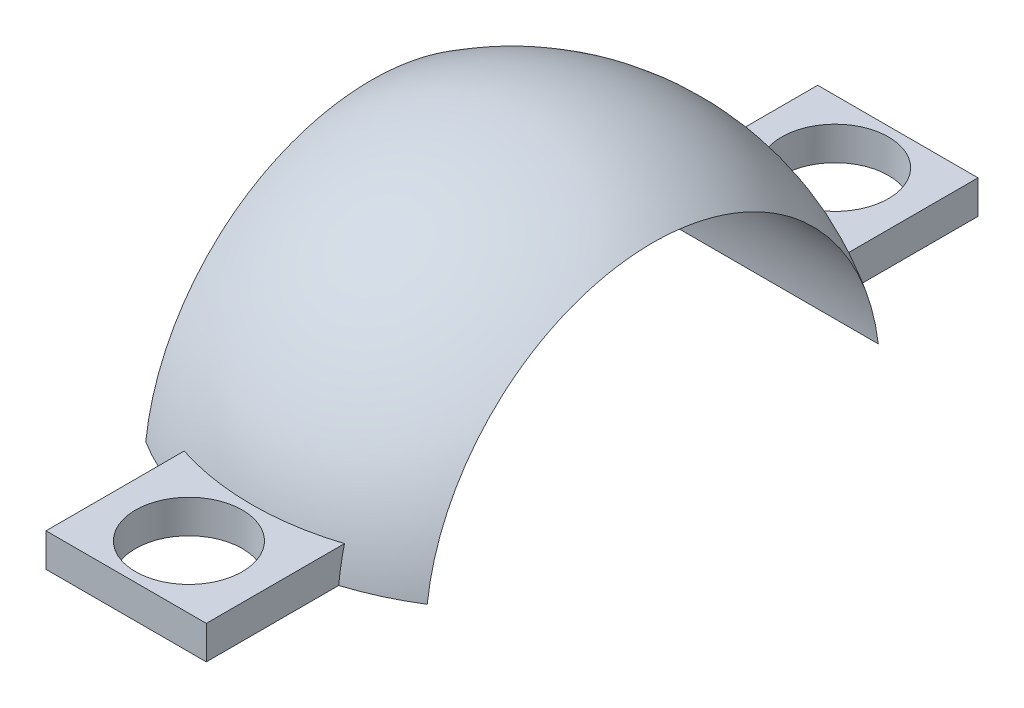
from build123d import *

# Parameters (mm, degrees)
SKETCH2_R                = 10
BOSS_EXTRUDE1_DEPTH      = 30
CUT_EXTRUDE1_START       = -10
SKETCH3_R                = 10
SKETCH3_R_2              = 7.5
CUT_EXTRUDE1_DEPTH       = 10
CUT_EXTRUDE3_DEPTH       = 10
CUT_EXTRUDE3_DEPTH_BACK  = 10
SKETCH5_R                = 2
FILLET2_R                = 10
BOSS_EXTRUDE2_START      = -67.5
SKETCH7_R                = 10
BOSS_EXTRUDE2_DEPTH      = 67.5
SKETCH8_R                = 50
SKETCH8_R_2              = 10
CUT_EXTRUDE6_DEPTH       = 107.770782567
SKETCH9_R                = 7.5
CUT_EXTRUDE7_DEPTH       = 10
CUT_EXTRUDE8_DEPTH       = 10
CUT_EXTRUDE8_DEPTH_BACK  = 10
SKETCH10_R               = 2
CUT_EXTRUDE9_START       = -60
SKETCH11_R               = 10
SKETCH11_R_2             = 7.5
CUT_EXTRUDE9_DEPTH       = 60
CUT_EXTRUDE10_START      = -60
SKETCH12_R               = 7.5
CUT_EXTRUDE10_DEPTH      = 60
CUT_EXTRUDE11_DEPTH      = 60
CUT_EXTRUDE11_DEPTH_BACK = 60
SKETCH14_R               = 8.5
CUT_EXTRUDE12_DEPTH      = 60
CUT_EXTRUDE12_DEPTH_BACK = 60
SKETCH15_W               = 22.666202576
SKETCH15_H               = 2
BOSS_EXTRUDE3_DEPTH      = 3
BOSS_EXTRUDE3_DEPTH_BACK = 3
SKETCH16_W               = 6
SKETCH16_H               = 1.25
SKETCH18_R               = 2
CUT_EXTRUDE13_DEPTH      = 6.5
CUT_EXTRUDE14_DEPTH      = 12.5
CUT_EXTRUDE14_DEPTH_BACK = 16.5
SKETCH19_W               = 29.24547319
SKETCH19_H               = 20.10627683


with BuildPart() as part:
    # Sketch1 → Revolve1 (revolve)
    with BuildSketch(Plane.XY):
        Polygon((50, 25), (0, 25), (0, 22.5), (45, 22.5), (45, -22.5), (0, -22.5), (0, -25), (50, -25), align=None)
    revolve(axis=Axis((0, -25, 0), (0, 1, 0)))

    # Sketch2 → Boss-Extrude1 (add)
    with BuildSketch(Plane(origin=(0, 25, 0), x_dir=(1, 0, 0), z_dir=(0, 1, 0))):
        with Locations(Location((0, 0, 0), (0, 0, 180))):
            Circle(SKETCH2_R)
    extrude(amount=BOSS_EXTRUDE1_DEPTH)

    # Sketch3 → Cut-Extrude1 (cut)
    with BuildSketch(Plane(origin=(0, 55, 0), x_dir=(1, 0, 0), z_dir=(0, 1, 0)).offset(CUT_EXTRUDE1_START)):
        with Locations(Location((0, 0, 0), (0, 0, 180))):
            Circle(SKETCH3_R)
        with Locations(Location((0, 0, 0), (0, 0, 180))):
            Circle(SKETCH3_R_2, mode=Mode.SUBTRACT)
    extrude(amount=CUT_EXTRUDE1_DEPTH, mode=Mode.SUBTRACT)

    # Sketch5 → Cut-Extrude3 (cut, two sides: drawn at the far end of the back side and taken through both)
    with BuildSketch(Plane(origin=(0, 0, 0), x_dir=(0, 0, -1), z_dir=(1, 0, 0)).offset(-CUT_EXTRUDE3_DEPTH_BACK)):
        with Locations(Location((0, 50, 0), (0, 0, 180))):
            Circle(SKETCH5_R)
    extrude(amount=CUT_EXTRUDE3_DEPTH + CUT_EXTRUDE3_DEPTH_BACK, mode=Mode.SUBTRACT)

    # Fillet2
    fillet2_edges = [part.edges().sort_by_distance(p)[0] for p in [
        (-50, 25, 0),
    ]]
    fillet(fillet2_edges, radius=FILLET2_R)

    # Sketch7 → Boss-Extrude2 (add)
    with BuildSketch(Plane(origin=(0, 45, 0), x_dir=(1, 0, 0), z_dir=(0, 1, 0)).offset(BOSS_EXTRUDE2_START)):
        with Locations(Location((0, 0, 0), (0, 0, 180))):
            Circle(SKETCH7_R)
    extrude(amount=BOSS_EXTRUDE2_DEPTH)

    # Sketch8 → Cut-Extrude6 (cut, through all)
    with BuildSketch(Plane(origin=(0, 55, 0), x_dir=(1, 0, 0), z_dir=(0, 1, 0))):
        Circle(SKETCH8_R)
        with Locations(Location((0, 0, 0), (0, 0, 180))):
            Circle(SKETCH8_R_2, mode=Mode.SUBTRACT)
    extrude(amount=-CUT_EXTRUDE6_DEPTH, mode=Mode.SUBTRACT)

    # Sketch9 → Cut-Extrude7 (cut)
    with BuildSketch(Plane.XZ.offset(25)):
        with Locations(Location((0, 0, 0), (0, 0, 180))):
            Circle(SKETCH9_R)
    extrude(amount=-CUT_EXTRUDE7_DEPTH, mode=Mode.SUBTRACT)

    # Sketch10 → Cut-Extrude8 (cut, two sides: drawn at the far end of the back side and taken through both)
    with BuildSketch(Plane(origin=(0, 0, 0), x_dir=(0, 0, -1), z_dir=(1, 0, 0)).offset(-CUT_EXTRUDE8_DEPTH_BACK)):
        with Locations(Location((0, -20, 0), (0, 0, 180))):
            Circle(SKETCH10_R)
    extrude(amount=CUT_EXTRUDE8_DEPTH + CUT_EXTRUDE8_DEPTH_BACK, mode=Mode.SUBTRACT)

    # Sketch11 → Cut-Extrude9 (cut)
    with BuildSketch(Plane(origin=(0, 55, 0), x_dir=(1, 0, 0), z_dir=(0, 1, 0)).offset(CUT_EXTRUDE9_START)):
        with Locations(Location((0, 0, 0), (0, 0, 180))):
            Circle(SKETCH11_R)
        Circle(SKETCH11_R_2, mode=Mode.SUBTRACT)
    extrude(amount=CUT_EXTRUDE9_DEPTH, mode=Mode.SUBTRACT)

    # Sketch12 → Cut-Extrude10 (cut)
    with BuildSketch(Plane(origin=(0, 55, 0), x_dir=(1, 0, 0), z_dir=(0, 1, 0)).offset(CUT_EXTRUDE10_START)):
        Circle(SKETCH12_R)
    extrude(amount=CUT_EXTRUDE10_DEPTH, mode=Mode.SUBTRACT)

    # Sketch13 → Revolve2 (revolve)
    with BuildSketch(Plane(origin=(0, 0, 0), x_dir=(0, 0, -1), z_dir=(1, 0, 0))):
        with BuildLine():
            Line((0, -15), (0, 5))
            ThreePointArc((0, 5), (-10, -5), (0, -15))
        make_face()
    revolve(axis=Axis((0, -15, 0), (0, 1, 0)))

    # Sketch14 → Cut-Extrude11 (cut, two sides: drawn at the far end of the back side and taken through both)
    with BuildSketch(Plane(origin=(0, 0, 0), x_dir=(0, 0, -1), z_dir=(1, 0, 0)).offset(-CUT_EXTRUDE11_DEPTH_BACK)):
        with Locations(Location((0, -5, 0), (0, 0, 180))):
            Circle(SKETCH14_R)
    extrude(amount=CUT_EXTRUDE11_DEPTH + CUT_EXTRUDE11_DEPTH_BACK, mode=Mode.SUBTRACT)

    # Sketch15 → Cut-Extrude12 (cut, two sides: drawn at the far end of the back side and taken through both)
    with BuildSketch(Plane(origin=(0, 0, 0), x_dir=(0, 0, -1), z_dir=(1, 0, 0)).offset(-CUT_EXTRUDE12_DEPTH_BACK)):
        with Locations((0, -5)):
            Rectangle(SKETCH15_W, SKETCH15_H)
    extrude(amount=CUT_EXTRUDE12_DEPTH + CUT_EXTRUDE12_DEPTH_BACK, mode=Mode.SUBTRACT)


with BuildPart() as cut_extrude12_piece_1:
    # of the separate pieces the step leaves, piece 1, a body of its own (cut_extrude12_pieces)
    add(part.part.solids().sort_by_distance((-10, -25, 0))[0])



with BuildPart() as cut_extrude12_piece_2:
    # of the separate pieces the step leaves, piece 2, a body of its own (cut_extrude12_pieces)
    add(part.part.solids().sort_by_distance((5.267826876, -4, 8.440971508))[0])


with BuildPart() as cut_extrude12_piece_1_1:
    add(cut_extrude12_piece_1.part)

    add(cut_extrude12_piece_2.part)  # Boss-Extrude3 merges Cut-Extrude12 piece 2
    # Sketch16 → Boss-Extrude3 (add, two sides: drawn at the far end of the back side and taken through both)
    with BuildSketch(Plane(origin=(0, 0, 0), x_dir=(0, 0, -1), z_dir=(1, 0, 0)).offset(-BOSS_EXTRUDE3_DEPTH_BACK)):
        with Locations((-11.440971508, -3.375)):
            Rectangle(SKETCH16_W, SKETCH16_H)
        with Locations((11.440971508, -3.375)):
            Rectangle(SKETCH16_W, SKETCH16_H)
        with Locations((11.440971508, -6.625)):
            Rectangle(SKETCH16_W, SKETCH16_H)
        with Locations((-11.440971508, -6.625)):
            Rectangle(SKETCH16_W, SKETCH16_H)
    extrude(amount=BOSS_EXTRUDE3_DEPTH + BOSS_EXTRUDE3_DEPTH_BACK)

    # Sketch18 → Cut-Extrude13 (cut)
    with BuildSketch(Plane(origin=(0, -2.75, 0), x_dir=(1, 0, 0), z_dir=(0, 1, 0))):
        with Locations(Location((0, 12.092279572, 0), (0, 0, 270))):
            Circle(SKETCH18_R)
        with Locations(Location((0, -12.092279572, 0), (0, 0, 90))):
            Circle(SKETCH18_R)
    extrude(amount=-CUT_EXTRUDE13_DEPTH, mode=Mode.SUBTRACT)

    # Sketch19 → Cut-Extrude14 (cut, two sides: drawn at the far end of the back side and taken through both)
    with BuildSketch(Plane(origin=(0, 0, 0), x_dir=(0, 0, -1), z_dir=(1, 0, 0)).offset(-CUT_EXTRUDE14_DEPTH_BACK)):
        with Locations((0.181765087, -16.053138415)):
            Rectangle(SKETCH19_W, SKETCH19_H)
    extrude(amount=CUT_EXTRUDE14_DEPTH + CUT_EXTRUDE14_DEPTH_BACK, mode=Mode.SUBTRACT)


solid = cut_extrude12_piece_1_1.part
